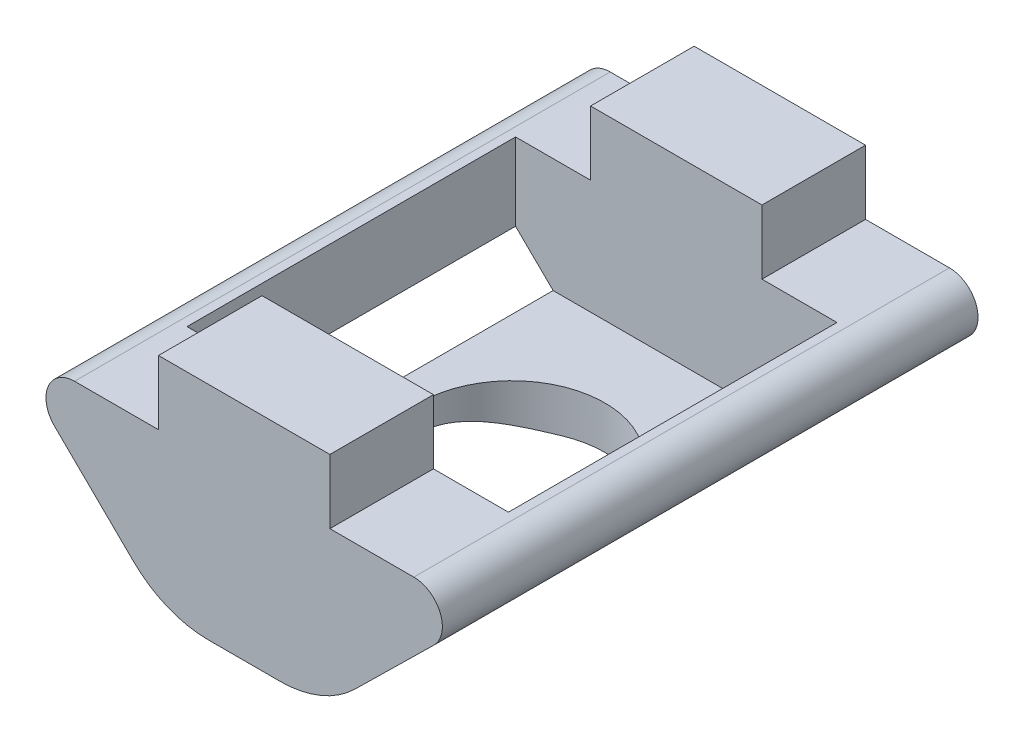
from build123d import *

# Parameters (mm, degrees)
BOSS_EXTRUDE1_DEPTH     = 15
SKETCH2_R               = 2.6
CUT_EXTRUDE1_DEPTH      = 18.153498186
CUT_EXTRUDE2_DEPTH      = 4.6
CUT_EXTRUDE2_DEPTH_BACK = 4.6
SKETCH6_W               = 9
SKETCH6_H               = 3.2
SKETCH7_W               = 9
SKETCH7_H               = 9.2
CUT_EXTRUDE3_DEPTH      = 17.588022904


with BuildPart() as part:
    # Sketch1 → Boss-Extrude1 (new body)
    with BuildSketch(Plane.XY):
        with BuildLine():
            Line((-4.75, 1.3), (-2.4, 1.3))
            Line((-2.4, 1.3), (-2.4, 3.1))
            Line((-2.4, 3.1), (2.4, 3.1))
            Line((2.4, 3.1), (2.4, 1.3))
            Line((2.4, 1.3), (4.75, 1.3))
            ThreePointArc((4.75, 1.3), (5.490454883, 0.802863939), (5.310642707, -0.070683586))
            Line((5.310642707, -0.070683586), (3.102410151, -2.240063447))
            ThreePointArc((3.102410151, -2.240063447), (2.135739772, -2.876705813), (1, -3.1))
            Line((1, -3.1), (-1, -3.1))
            ThreePointArc((-1, -3.1), (-2.135739772, -2.876705813), (-3.102410151, -2.240063447))
            Line((-3.102410151, -2.240063447), (-5.310642707, -0.070683586))
            ThreePointArc((-5.310642707, -0.070683586), (-5.490454883, 0.802863939), (-4.75, 1.3))
        make_face()
    extrude(amount=BOSS_EXTRUDE1_DEPTH)

    # Sketch2 → Cut-Extrude1 (cut, through all)
    with BuildSketch(Plane(origin=(0, 3.1, 0), x_dir=(1, 0, 0), z_dir=(0, 1, 0))):
        with Locations(Location((0, -7.5, 0), (0, 0, 247.380135052))):
            Circle(SKETCH2_R)
    extrude(amount=-CUT_EXTRUDE1_DEPTH, mode=Mode.SUBTRACT)

    # Sketch6 → Cut-Extrude2 (cut, two sides: drawn at the far end of the back side and taken through both)
    with BuildSketch(Plane.XY.offset(7.5).offset(-CUT_EXTRUDE2_DEPTH_BACK)):
        with Locations((0, -0.3)):
            Rectangle(SKETCH6_W, SKETCH6_H)
    extrude(amount=CUT_EXTRUDE2_DEPTH + CUT_EXTRUDE2_DEPTH_BACK, mode=Mode.SUBTRACT)

    # Sketch7 → Cut-Extrude3 (cut, through all)
    with BuildSketch(Plane(origin=(0, 1.3, 0), x_dir=(1, 0, 0), z_dir=(0, 1, 0))):
        with Locations((0, -7.5)):
            Rectangle(SKETCH7_W, SKETCH7_H)
    extrude(amount=CUT_EXTRUDE3_DEPTH, mode=Mode.SUBTRACT)


solid = part.part
